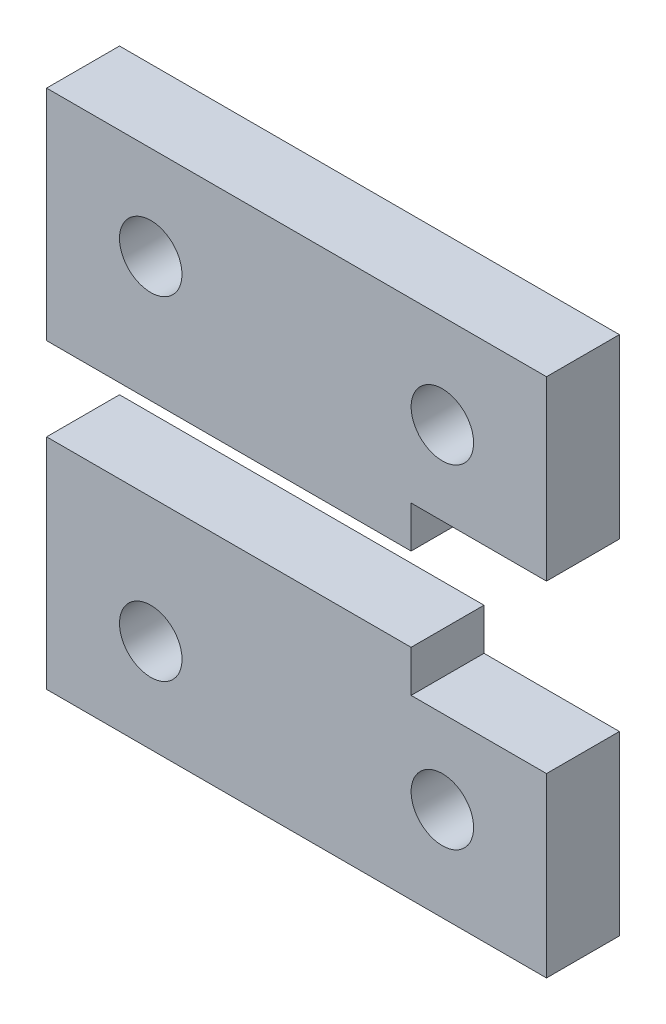
from build123d import *

# Parameters (mm, degrees)
CROQUIS1_R                = 1.5
SALIENTE_EXTRUIR1_DEPTH   = 3.5
SALIENTE_EXTRUIR1_2_DEPTH = 3.5


with BuildPart() as part:
    # Croquis1 → Saliente-Extruir1 (new body)
    with BuildSketch(Plane.XY):
        Polygon((17.5, 8.5), (17.5, 10.5), (0, 10.5), (0, 0), (24, 0), (24, 8.5), align=None)
        with Locations((5, 4.5)):
            Circle(CROQUIS1_R, mode=Mode.SUBTRACT)
        with Locations((19, 4.5)):
            Circle(CROQUIS1_R, mode=Mode.SUBTRACT)
    extrude(amount=SALIENTE_EXTRUIR1_DEPTH)


with BuildPart() as body_2:
    # Croquis1 → Saliente-Extruir1 2 (new body)
    with BuildSketch(Plane.XY):
        Polygon((0, 14.5), (0, 25), (24, 25), (24, 16.5), (17.5, 16.5), (17.5, 14.5), align=None)
        with Locations(Location((19, 20.5, 0), (0, 0, 180))):
            Circle(CROQUIS1_R, mode=Mode.SUBTRACT)
        with Locations(Location((5, 20.5, 0), (0, 0, 180))):
            Circle(CROQUIS1_R, mode=Mode.SUBTRACT)
    extrude(amount=SALIENTE_EXTRUIR1_2_DEPTH)


solid = Compound([part.part, body_2.part])
